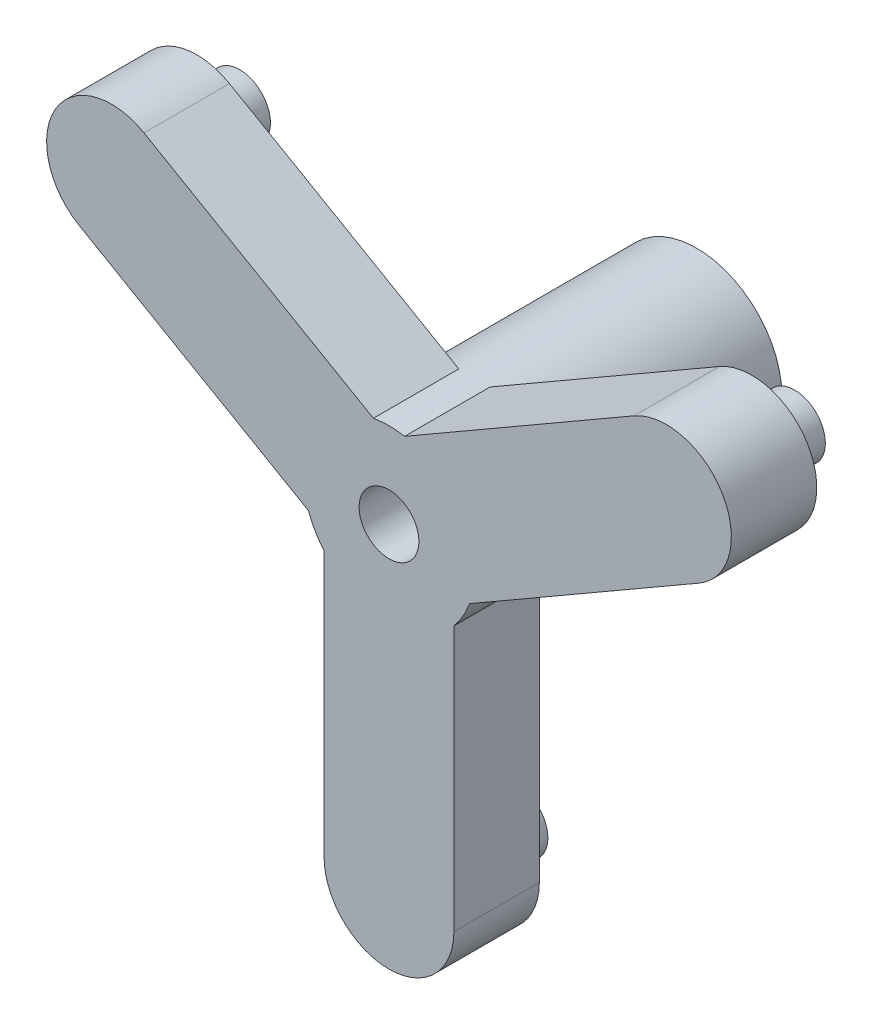
from build123d import *

# Parameters (mm, degrees)
SKETCH1_R           = 6.35
BOSS_EXTRUDE1_DEPTH = 16.51
BOSS_EXTRUDE4_DEPTH = 6.35
SKETCH6_R           = 2.286
BOSS_EXTRUDE5_DEPTH = 3.175
SKETCH7_R           = 2.2225
CUT_EXTRUDE1_DEPTH  = 45.613402568


with BuildPart() as part:
    # Sketch1 → Boss-Extrude1 (new body)
    with BuildSketch(Plane.XY):
        Circle(SKETCH1_R)
    extrude(amount=BOSS_EXTRUDE1_DEPTH)

    # Sketch4 → Boss-Extrude4 (add)
    with BuildSketch(Plane.XY.offset(16.51)):
        with BuildLine():
            Line((-4.826, -4.12701151), (-4.826, -23.8125))
            ThreePointArc((-4.826, -23.8125), (0, -28.6385), (4.826, -23.8125))
            Line((4.826, -23.8125), (4.826, -4.12701151))
            ThreePointArc((4.826, -4.12701151), (5.499261314, -3.175), (5.987096809, -2.115932844))
            Line((5.987096809, -2.115932844), (23.035229928, 7.726811401))
            ThreePointArc((23.035229928, 7.726811401), (24.801668526, 14.31925), (18.209229928, 16.085688599))
            Line((18.209229928, 16.085688599), (1.161096809, 6.242944353))
            ThreePointArc((1.161096809, 6.242944353), (0, 6.35), (-1.161096809, 6.242944353))
            Line((-1.161096809, 6.242944353), (-18.209229928, 16.085688599))
            ThreePointArc((-18.209229928, 16.085688599), (-24.801668526, 14.31925), (-23.035229928, 7.726811401))
            Line((-23.035229928, 7.726811401), (-5.987096809, -2.115932844))
            ThreePointArc((-5.987096809, -2.115932844), (-5.499261314, -3.175), (-4.826, -4.12701151))
        make_face()
    extrude(amount=BOSS_EXTRUDE4_DEPTH)

    # Sketch6 → Boss-Extrude5 (add)
    with BuildSketch(Plane(origin=(0, 0, 16.51), x_dir=(-1, 0, 0), z_dir=(0, 0, -1))):
        with Locations(Location((0, -23.8125, 0), (0, 0, 180))):
            Circle(SKETCH6_R)
        with Locations(Location((-20.622229928, 11.90625, 0), (0, 0, 180))):
            Circle(SKETCH6_R)
        with Locations(Location((20.622229928, 11.90625, 0), (0, 0, 180))):
            Circle(SKETCH6_R)
    extrude(amount=BOSS_EXTRUDE5_DEPTH)

    # Sketch7 → Cut-Extrude1 (cut, through all)
    with BuildSketch(Plane(origin=(0, 0, 0), x_dir=(-1, 0, 0), z_dir=(0, 0, -1))):
        Circle(SKETCH7_R)
    extrude(amount=-CUT_EXTRUDE1_DEPTH, mode=Mode.SUBTRACT)


solid = part.part
